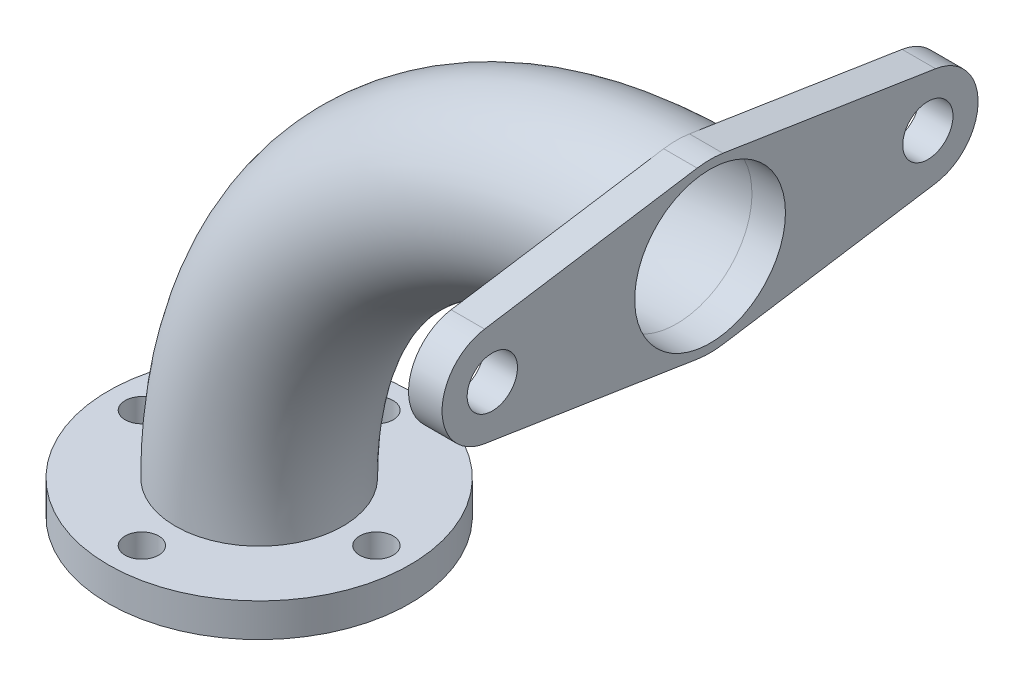
from build123d import *

# Parameters (mm, degrees)
SKETCH1_R           = 45
SKETCH1_R_2         = 5
SKETCH1_R_3         = 22.5
BOSS_EXTRUDE1_DEPTH = 10
SKETCH3_R           = 25
SKETCH3_R_2         = 22.5
SKETCH4_R           = 7.5
SKETCH4_R_2         = 25
SKETCH4_R_3         = 22.5
BOSS_EXTRUDE6_DEPTH = 10


with BuildPart() as part:
    # Sketch1 → Boss-Extrude1 (new body)
    with BuildSketch(Plane(origin=(0, 0, 0), x_dir=(1, 0, 0), z_dir=(0, 1, 0))):
        with Locations(Location((0, 0, 0), (0, 0, 270))):
            Circle(SKETCH1_R)
        with Locations(Location((0, 35, 0), (0, 0, 270))):
            Circle(SKETCH1_R_2, mode=Mode.SUBTRACT)
        with Locations(Location((35, 0, 0), (0, 0, 270))):
            Circle(SKETCH1_R_2, mode=Mode.SUBTRACT)
        with Locations(Location((0, -35, 0), (0, 0, 270))):
            Circle(SKETCH1_R_2, mode=Mode.SUBTRACT)
        with Locations(Location((-35, 0, 0), (0, 0, 270))):
            Circle(SKETCH1_R_2, mode=Mode.SUBTRACT)
        with Locations(Location((0, 0, 0), (0, 0, 270))):
            Circle(SKETCH1_R_3, mode=Mode.SUBTRACT)
    extrude(amount=BOSS_EXTRUDE1_DEPTH)

    # Sweep1: sweep along a path in Sketch2
    with BuildLine(Plane.XY) as sweep1_path:
        ThreePointArc((124.599357944, 135), (36.211010295, 98.388347648), (-0.400642056, 10))
    # Sketch3 → Sweep1 (sweep)
    with BuildSketch(Plane(origin=(0, 10, 0), x_dir=(1, 0, 0), z_dir=(0, 1, 0))):
        Circle(SKETCH3_R)
        Circle(SKETCH3_R_2, mode=Mode.SUBTRACT)
    sweep(path=sweep1_path.line)

    # Sketch4 → Boss-Extrude6 (add)
    # profile 1 of 3: a face of its own
    with BuildSketch(Plane(origin=(124.599357944, 0, 0), x_dir=(0, 0, -1), z_dir=(1, 0, 0))):
        with BuildLine():
            ThreePointArc((-3.846153846, 109.8969876), (-25, 134.599357944), (-3.846153846, 159.301728287))
            Line((-3.846153846, 159.301728287), (-67.307692308, 149.42078015))
            ThreePointArc((-67.307692308, 149.42078015), (-80, 134.599357944), (-67.307692308, 119.777935738))
            Line((-67.307692308, 119.777935738), (-3.846153846, 109.8969876))
        make_face()
        with Locations((-65, 134.599357944)):
            Circle(SKETCH4_R, mode=Mode.SUBTRACT)
    # profile 2 of 3: a face of its own
    with BuildSketch(Plane(origin=(124.599357944, 0, 0), x_dir=(0, 0, -1), z_dir=(1, 0, 0))):
        with BuildLine():
            Line((67.307692308, 149.42078015), (3.846153846, 159.301728287))
            ThreePointArc((3.846153846, 159.301728287), (18.988863133, 150.860448833), (25, 134.599357944))
            ThreePointArc((25, 134.599357944), (18.988863133, 118.338267054), (3.846153846, 109.8969876))
            Line((3.846153846, 109.8969876), (67.307692308, 119.777935738))
            ThreePointArc((67.307692308, 119.777935738), (80, 134.599357944), (67.307692308, 149.42078015))
        make_face()
        with Locations((65, 134.599357944)):
            Circle(SKETCH4_R, mode=Mode.SUBTRACT)
    # profile 3 of 3: a face of its own
    with BuildSketch(Plane(origin=(124.599357944, 0, 0), x_dir=(0, 0, -1), z_dir=(1, 0, 0))):
        with Locations((0, 134.599357944)):
            Circle(SKETCH4_R_2)
        with Locations(Location((0, 134.599357944, 0), (0, 0, 90))):
            Circle(SKETCH4_R_3, mode=Mode.SUBTRACT)
    extrude(amount=BOSS_EXTRUDE6_DEPTH)


solid = part.part
